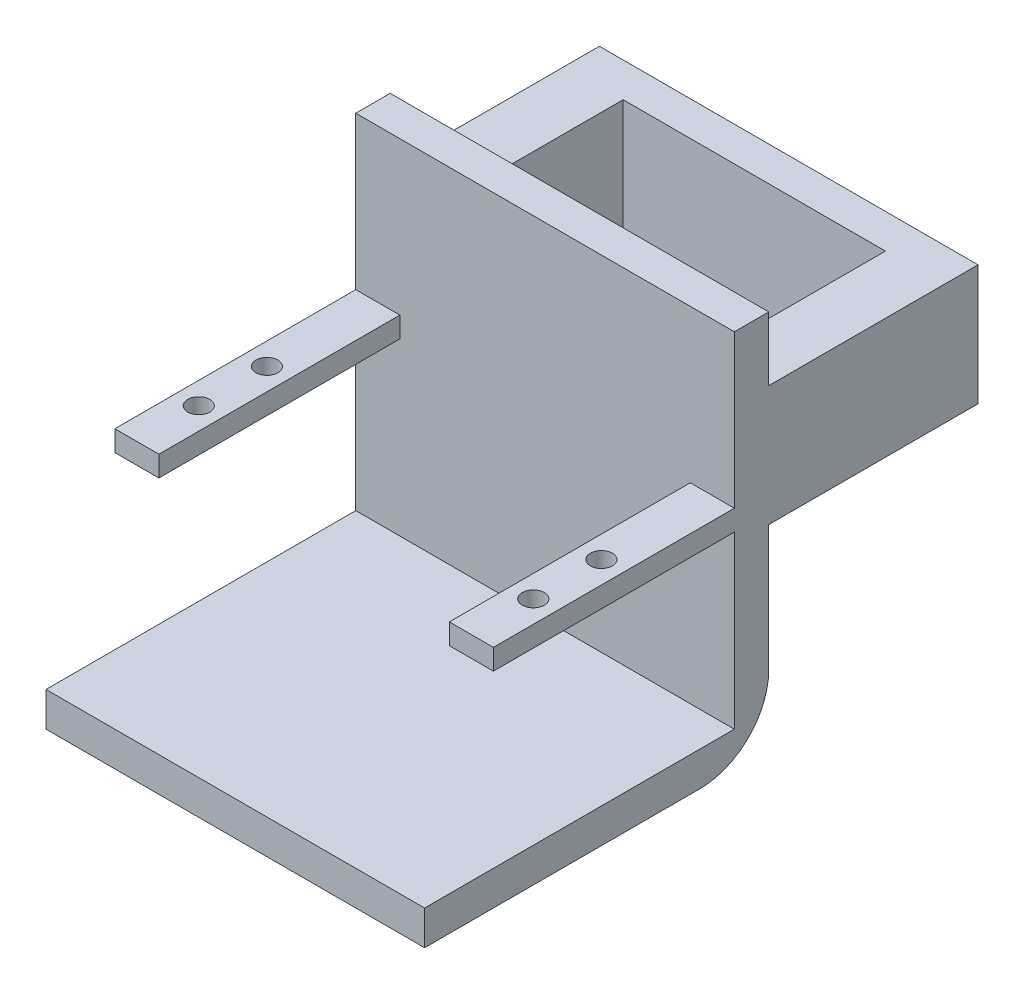
from build123d import *

# Parameters (mm, degrees)
SKETCH1_W           = 55
SKETCH1_H           = 55
BOSS_EXTRUDE1_DEPTH = 50
SKETCH2_W           = 55
SKETCH2_H           = 50
CUT_EXTRUDE1_DEPTH  = 45
FILLET2_R           = 10
SKETCH3_W           = 6.4
SKETCH3_H           = 3
BOSS_EXTRUDE2_DEPTH = 35
SKETCH4_R           = 1.6
CUT_EXTRUDE2_DEPTH  = 10
SKETCH5_W           = 8.45
SKETCH5_H           = 17.487110786
BOSS_EXTRUDE3_DEPTH = 25.4
SKETCH6_W           = 55
SKETCH6_H           = 17.487110786
BOSS_EXTRUDE4_DEPTH = 5


with BuildPart() as part:
    # Sketch1 → Boss-Extrude1 (new body)
    with BuildSketch(Plane.XY):
        with Locations((7.085987261, 0.398089172)):
            Rectangle(SKETCH1_W, SKETCH1_H)
    extrude(amount=BOSS_EXTRUDE1_DEPTH)

    # Sketch2 → Cut-Extrude1 (cut)
    with BuildSketch(Plane.XY.offset(50)):
        with Locations((7.085987261, 2.898089172)):
            Rectangle(SKETCH2_W, SKETCH2_H)
    extrude(amount=-CUT_EXTRUDE1_DEPTH, mode=Mode.SUBTRACT)

    # Fillet2
    fillet2_edges = [part.edges().sort_by_distance(p)[0] for p in [
        (7.085987261, -27.101910828, 0),
    ]]
    fillet(fillet2_edges, radius=FILLET2_R)

    # Sketch3 → Boss-Extrude2 (add)
    with BuildSketch(Plane.XY.offset(5)):
        with Locations((-17.214012739, 4.198089172)):
            Rectangle(SKETCH3_W, SKETCH3_H)
        with Locations((31.385987261, 4.198089172)):
            Rectangle(SKETCH3_W, SKETCH3_H)
    extrude(amount=BOSS_EXTRUDE2_DEPTH)

    # Sketch4 → Cut-Extrude2 (cut)
    with BuildSketch(Plane(origin=(0, 5.698089172, 0), x_dir=(1, 0, 0), z_dir=(0, 1, 0))):
        with Locations(Location((-17.214012739, -21.11, 0), (0, 0, 180))):
            Circle(SKETCH4_R)
        with Locations(Location((-17.214012739, -31.01, 0), (0, 0, 180))):
            Circle(SKETCH4_R)
        with Locations(Location((31.385987261, -31.01, 0), (0, 0, 180))):
            Circle(SKETCH4_R)
        with Locations(Location((31.385987261, -21.11, 0), (0, 0, 180))):
            Circle(SKETCH4_R)
    extrude(amount=-CUT_EXTRUDE2_DEPTH, mode=Mode.SUBTRACT)

    # Sketch5 → Boss-Extrude3 (add)
    with BuildSketch(Plane(origin=(0, 0, 0), x_dir=(-1, 0, 0), z_dir=(0, 0, -1))):
        with Locations((-30.360987261, 9.878461031)):
            Rectangle(SKETCH5_W, SKETCH5_H)
        with Locations((16.189012739, 9.878461031)):
            Rectangle(SKETCH5_W, SKETCH5_H)
    extrude(amount=BOSS_EXTRUDE3_DEPTH)

    # Sketch6 → Boss-Extrude4 (add)
    with BuildSketch(Plane(origin=(0, 0, -25.4), x_dir=(-1, 0, 0), z_dir=(0, 0, -1))):
        with Locations((-7.085987261, 9.878461031)):
            Rectangle(SKETCH6_W, SKETCH6_H)
    extrude(amount=BOSS_EXTRUDE4_DEPTH)


solid = part.part
